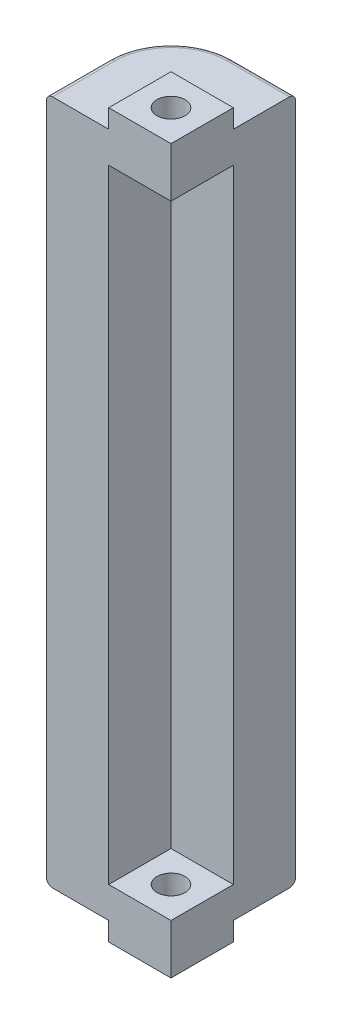
from build123d import *

# Parameters (mm, degrees)
BOSS_EXTRUDE1_DEPTH  = 55
BOSS_EXTRUDE2_START  = -5
SKETCH3_W            = 10
SKETCH3_H            = 10
BOSS_EXTRUDE2_DEPTH  = 8
M4_CLEARANCE_HOLE1_D = 4.5
FILLET2_R            = 10
FILLET3_R            = 1


with BuildPart() as part:
    # Sketch2 → Boss-Extrude1 (new, symmetric)
    with BuildSketch(Plane(origin=(0, 0, 0), x_dir=(1, 0, 0), z_dir=(0, 1, 0))):
        Polygon((0, 0), (20, 0), (20, -10), (10, -10), (10, -20), (0, -20), align=None)
    extrude(amount=BOSS_EXTRUDE1_DEPTH, both=True)

    # Sketch3 → Boss-Extrude2 (add)
    with BuildSketch(Plane(origin=(0, 55, 0), x_dir=(1, 0, 0), z_dir=(0, 1, 0)).offset(BOSS_EXTRUDE2_START)):
        with Locations((15, -15)):
            Rectangle(SKETCH3_W, SKETCH3_H)
    boss_extrude2 = extrude(amount=BOSS_EXTRUDE2_DEPTH)

    # M4 Clearance Hole1 (through all)
    with Locations(Plane(origin=(15, 50, 15), x_dir=(0, 0, -1), z_dir=(0, -1, 0))):
        with Locations((0, 0)):
            m4_clearance_hole1 = Hole(M4_CLEARANCE_HOLE1_D / 2)

    # Mirror1: Boss-Extrude2, M4 Clearance Hole1 across plane
    add(boss_extrude2.mirror(Plane.ZX))
    add(m4_clearance_hole1.mirror(Plane.ZX), mode=Mode.SUBTRACT)

    # Fillet2
    fillet2_edges = [part.edges().sort_by_distance(p)[0] for p in [
        (0, 0, 0),
    ]]
    fillet(fillet2_edges, radius=FILLET2_R)

    # Fillet3
    fillet3_edges = [part.edges().sort_by_distance(p)[0] for p in [
        (15, 55, 0),
        (0, -55, 15),
        (0, 55, 15),
        (2.928932188, -55, 2.928932188),
        (2.928932188, 55, 2.928932188),
        (15, -55, 0),
    ]]
    fillet(fillet3_edges, radius=FILLET3_R)


solid = part.part
